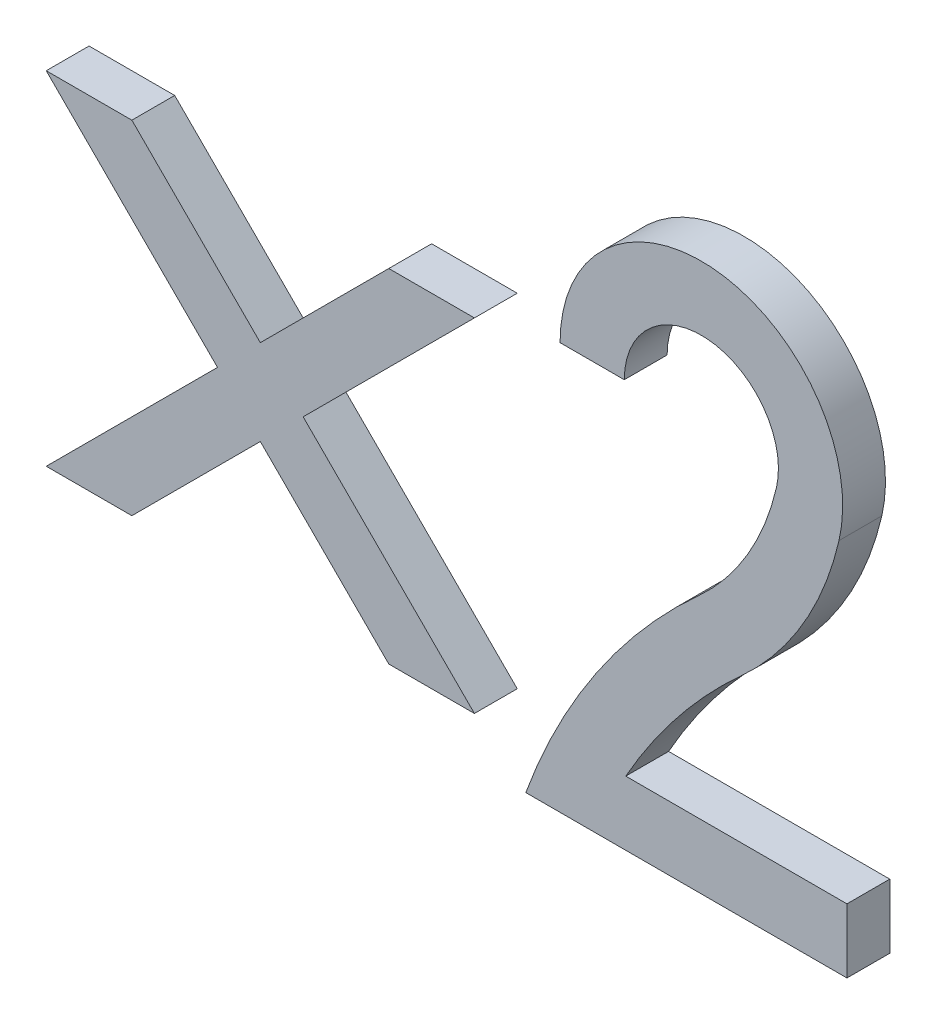
from build123d import *

# Parameters (mm, degrees)
BOSS_EXTRUDE1_DEPTH   = 10
BOSS_EXTRUDE1_2_DEPTH = 10


with BuildPart() as part:
    # Sketch1 → Boss-Extrude1 (new body)
    with BuildSketch(Plane.XY):
        Polygon((-50, 40), (-10, 0), (-50, -40), (-30, -40), (0, -10), (30, -40), (50, -40), (10, 0), (50, 40), (30, 40), (0, 10), (-30, 40), align=None)
    extrude(amount=BOSS_EXTRUDE1_DEPTH)


with BuildPart() as body_2:
    # Sketch1 → Boss-Extrude1 2 (new body)
    with BuildSketch(Plane.XY):
        with BuildLine():
            Line((85.342663494, -35), (137, -35))
            Line((137, -35), (137, -50))
            Line((137, -50), (62, -50))
            ThreePointArc((62, -50), (78.501893933, -17.532986448), (102.342072826, 10))
            ThreePointArc((102.342072826, 10), (113.804890183, 24.074187919), (120.534343564, 40.932224712))
            ThreePointArc((120.534343564, 40.932224712), (105.047170713, 62.883206985), (85, 45))
            Line((85, 45), (70, 45))
            ThreePointArc((70, 45), (106.753146307, 77.785879473), (135.146296533, 37.542411972))
            ThreePointArc((135.146296533, 37.542411972), (126.734479807, 16.46986598), (112.405958111, -1.122868918))
            ThreePointArc((112.405958111, -1.122868918), (97.505325355, -16.967798271), (85.342663494, -35))
        make_face()
    extrude(amount=BOSS_EXTRUDE1_2_DEPTH)


solid = Compound([part.part, body_2.part])
